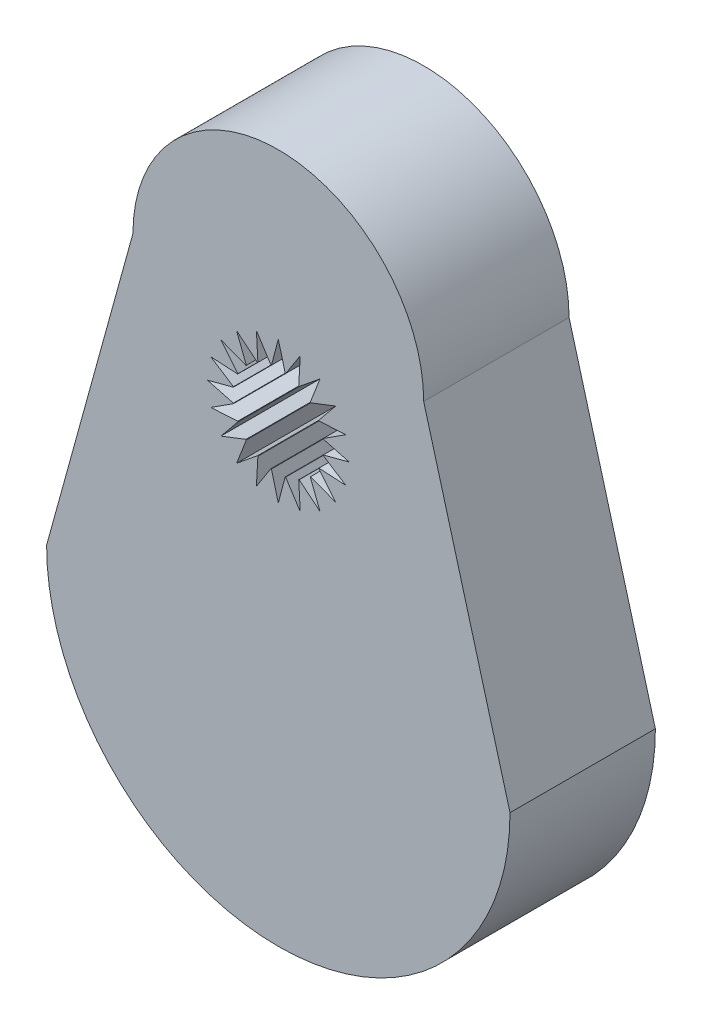
from build123d import *

# Parameters (mm, degrees)
EXTRUDE_1_DEPTH     = 10
CUT_EXTRUDE_2_DEPTH = 8


with BuildPart() as part:
    # 草图1 → 凸台-拉伸1 (new body)
    with BuildSketch(Plane.XY):
        with BuildLine():
            Line((-10, 24.791076412), (-15.93770494, 3.262397709))
            ThreePointArc((-15.93770494, 3.262397709), (0, -12.675307231), (15.93770494, 3.262397709))
            Line((15.93770494, 3.262397709), (10, 24.791076412))
            ThreePointArc((10, 24.791076412), (0, 34.791076412), (-10, 24.791076412))
        make_face()
    extrude(amount=-EXTRUDE_1_DEPTH)

    # 草图3 → 切除-拉伸2 (cut)
    with BuildSketch(Plane.XY):
        with BuildLine():
            Line((0, 23.501027712), (-0.472402553, 21.711669494))
            ThreePointArc((-0.472402553, 21.711669494), (-0.489109338, 21.709069686), (-0.50580182, 21.70637957))
            Line((-0.50580182, 21.70637957), (-1.508025445, 23.262179946))
            Line((-1.508025445, 23.262179946), (-1.404364874, 21.414418736))
            ThreePointArc((-1.404364874, 21.414418736), (-1.419450586, 21.40678349), (-1.434494788, 21.399066778))
            Line((-1.434494788, 21.399066778), (-2.868434853, 22.569016731))
            Line((-2.868434853, 22.569016731), (-2.198858175, 20.84372427))
            ThreePointArc((-2.198858175, 20.84372427), (-2.210846119, 20.831800979), (-2.22276941, 20.819813035))
            Line((-2.22276941, 20.819813035), (-3.948061872, 21.489389712))
            Line((-3.948061872, 21.489389712), (-2.778111918, 20.055449647))
            ThreePointArc((-2.778111918, 20.055449647), (-2.785828631, 20.040405445), (-2.793463876, 20.025319733))
            Line((-2.793463876, 20.025319733), (-4.641225087, 20.128980305))
            Line((-4.641225087, 20.128980305), (-3.085424711, 19.12675668))
            ThreePointArc((-3.085424711, 19.12675668), (-3.088114827, 19.110064198), (-3.090714635, 19.093357413))
            Line((-3.090714635, 19.093357413), (-4.880072853, 18.620954859))
            Line((-4.880072853, 18.620954859), (-3.090714635, 18.148552306))
            ThreePointArc((-3.090714635, 18.148552306), (-3.088114827, 18.131845521), (-3.085424711, 18.115153039))
            Line((-3.085424711, 18.115153039), (-4.641225087, 17.112929414))
            Line((-4.641225087, 17.112929414), (-2.793463876, 17.216589986))
            ThreePointArc((-2.793463876, 17.216589986), (-2.785828631, 17.201504274), (-2.778111918, 17.186460072))
            Line((-2.778111918, 17.186460072), (-3.948061872, 15.752520006))
            Line((-3.948061872, 15.752520006), (-2.22276941, 16.422096684))
            ThreePointArc((-2.22276941, 16.422096684), (-2.210846119, 16.41010874), (-2.198858175, 16.398185449))
            Line((-2.198858175, 16.398185449), (-2.868434853, 14.672892987))
            Line((-2.868434853, 14.672892987), (-1.434494788, 15.842842941))
            ThreePointArc((-1.434494788, 15.842842941), (-1.419450586, 15.835126228), (-1.404364874, 15.827490983))
            Line((-1.404364874, 15.827490983), (-1.508025445, 13.979729772))
            Line((-1.508025445, 13.979729772), (-0.50580182, 15.535530148))
            ThreePointArc((-0.50580182, 15.535530148), (-0.489109338, 15.532840033), (-0.472402553, 15.530240224))
            Line((-0.472402553, 15.530240224), (0, 13.740882006))
            Line((0, 13.740882006), (0.472402553, 15.530240224))
            ThreePointArc((0.472402553, 15.530240224), (0.489109338, 15.532840033), (0.50580182, 15.535530148))
            Line((0.50580182, 15.535530148), (1.508025445, 13.979729772))
            Line((1.508025445, 13.979729772), (1.404364874, 15.827490983))
            ThreePointArc((1.404364874, 15.827490983), (1.419450586, 15.835126228), (1.434494788, 15.842842941))
            Line((1.434494788, 15.842842941), (2.868434853, 14.672892987))
            Line((2.868434853, 14.672892987), (2.198858175, 16.398185449))
            ThreePointArc((2.198858175, 16.398185449), (2.210846119, 16.41010874), (2.22276941, 16.422096684))
            Line((2.22276941, 16.422096684), (3.948061872, 15.752520006))
            Line((3.948061872, 15.752520006), (2.778111918, 17.186460072))
            ThreePointArc((2.778111918, 17.186460072), (2.785828631, 17.201504274), (2.793463876, 17.216589986))
            Line((2.793463876, 17.216589986), (4.641225087, 17.112929414))
            Line((4.641225087, 17.112929414), (3.085424711, 18.115153039))
            ThreePointArc((3.085424711, 18.115153039), (3.088114827, 18.131845521), (3.090714635, 18.148552306))
            Line((3.090714635, 18.148552306), (4.880072853, 18.620954859))
            Line((4.880072853, 18.620954859), (3.090714635, 19.093357413))
            ThreePointArc((3.090714635, 19.093357413), (3.088114827, 19.110064198), (3.085424711, 19.12675668))
            Line((3.085424711, 19.12675668), (4.641225087, 20.128980305))
            Line((4.641225087, 20.128980305), (2.793463876, 20.025319733))
            ThreePointArc((2.793463876, 20.025319733), (2.785828631, 20.040405445), (2.778111918, 20.055449647))
            Line((2.778111918, 20.055449647), (3.948061872, 21.489389712))
            Line((3.948061872, 21.489389712), (2.22276941, 20.819813035))
            ThreePointArc((2.22276941, 20.819813035), (2.210846119, 20.831800979), (2.198858175, 20.84372427))
            Line((2.198858175, 20.84372427), (2.868434853, 22.569016731))
            Line((2.868434853, 22.569016731), (1.434494788, 21.399066778))
            ThreePointArc((1.434494788, 21.399066778), (1.419450586, 21.40678349), (1.404364874, 21.414418736))
            Line((1.404364874, 21.414418736), (1.508025445, 23.262179946))
            Line((1.508025445, 23.262179946), (0.50580182, 21.70637957))
            ThreePointArc((0.50580182, 21.70637957), (0.489109338, 21.709069686), (0.472402553, 21.711669494))
            Line((0.472402553, 21.711669494), (0, 23.501027712))
        make_face()
    extrude(amount=-CUT_EXTRUDE_2_DEPTH, mode=Mode.SUBTRACT)


solid = part.part
